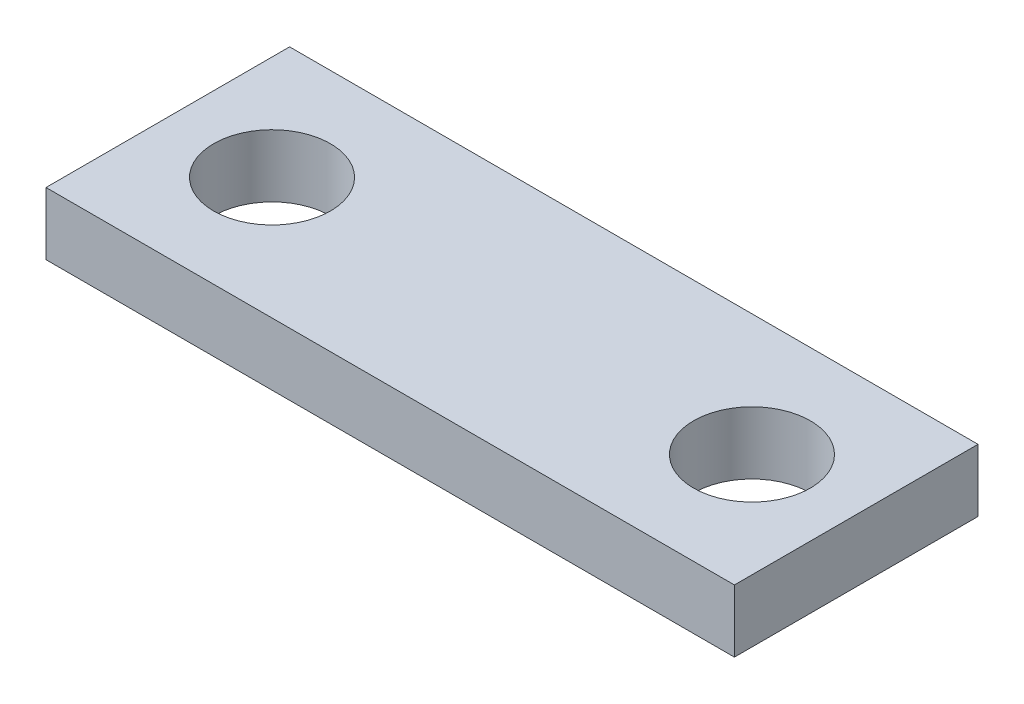
from build123d import *

# Parameters (mm, degrees)
SKETCH1_W           = 16.51
SKETCH1_H           = 5.842
BOSS_EXTRUDE1_DEPTH = 1.5
SKETCH2_R           = 1.4
CUT_EXTRUDE1_DEPTH  = 1.5


with BuildPart() as part:
    # Sketch1 → Boss-Extrude1 (new body)
    with BuildSketch(Plane(origin=(0, 0, 0), x_dir=(1, 0, 0), z_dir=(0, 1, 0))):
        Rectangle(SKETCH1_W, SKETCH1_H)
    extrude(amount=BOSS_EXTRUDE1_DEPTH)

    # Sketch2 → Cut-Extrude1 (cut)
    with BuildSketch(Plane(origin=(0, 1.5, 0), x_dir=(1, 0, 0), z_dir=(0, 1, 0))):
        with Locations(Location((-5.755, 0, 0), (0, 0, 270))):
            Circle(SKETCH2_R)
        with Locations(Location((5.755, 0, 0), (0, 0, 270))):
            Circle(SKETCH2_R)
    extrude(amount=-CUT_EXTRUDE1_DEPTH, mode=Mode.SUBTRACT)


solid = part.part
